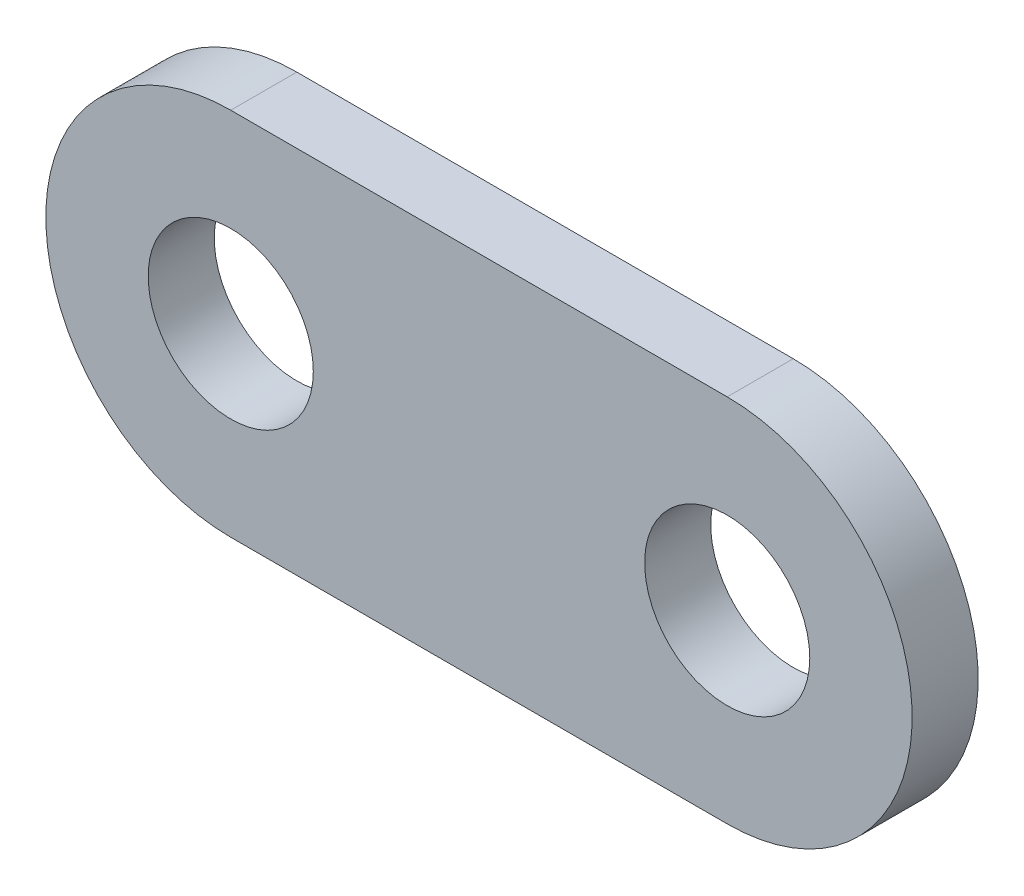
from build123d import *

# Parameters (mm, degrees)
SKETCH_1_R      = 1.250000002
SKETCH_1_R_2    = 1.25
EXTRUDE_1_DEPTH = 1


with BuildPart() as part:
    # 草图1 → 凸台-拉伸1 (new body)
    with BuildSketch(Plane.XY):
        with BuildLine():
            Line((3.758518176, -94.715193203), (-3.758518176, -94.715193203))
            ThreePointArc((-3.758518176, -94.715193203), (-6.558518176, -97.515193203), (-3.758518176, -100.315193203))
            Line((-3.758518176, -100.315193203), (3.758518176, -100.315193203))
            ThreePointArc((3.758518176, -100.315193203), (6.558518176, -97.515193203), (3.758518176, -94.715193203))
        make_face()
        with Locations((3.758518176, -97.515193203)):
            Circle(SKETCH_1_R, mode=Mode.SUBTRACT)
        with Locations((-3.758518176, -97.515193203)):
            Circle(SKETCH_1_R_2, mode=Mode.SUBTRACT)
    extrude(amount=EXTRUDE_1_DEPTH)


solid = part.part
